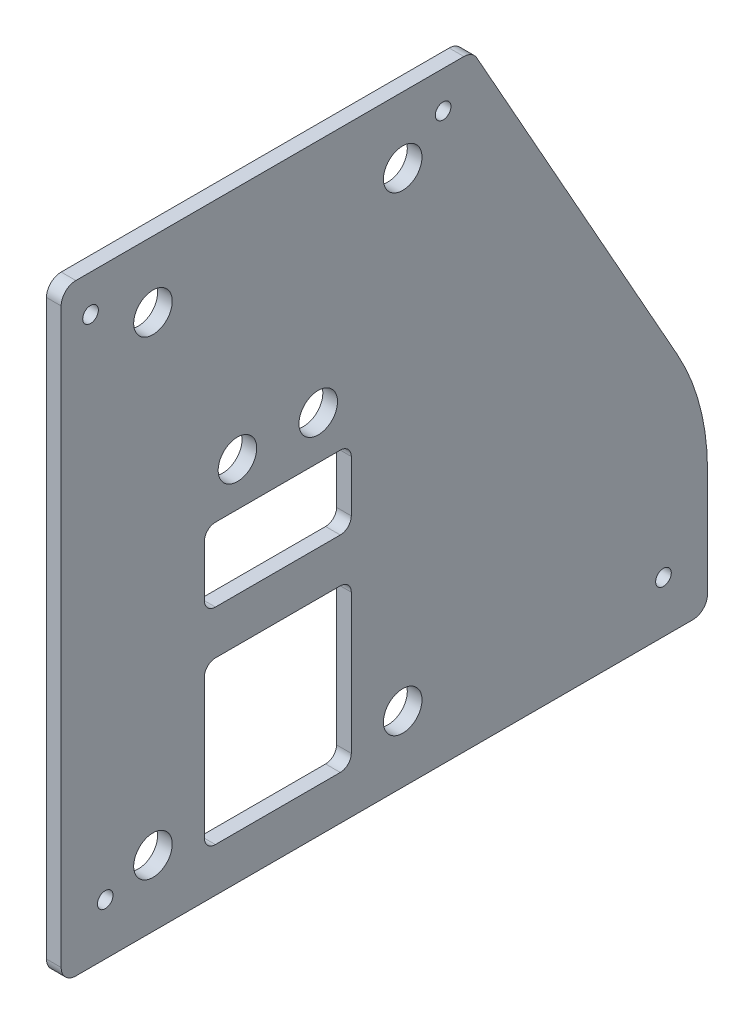
from build123d import *

# Parameters (mm, degrees)
BOSS_EXTRUDE1_DEPTH     = 6.35
F_1_4_CLEARANCE_HOLE4_D = 6.7564
F_1_4_CLEARANCE_HOLE5_D = 6.7564
FILLET4_R               = 101.6
SKETCH22_W              = 63.5
SKETCH22_H              = 69.85
SKETCH22_H_2            = 31.75
CUT_EXTRUDE1_DEPTH      = 380.794237878
F_5_8_CLEARANCE_HOLE1_D = 16.66748
FILLET5_R               = 6.35
FILLET6_R               = 4.7625


with BuildPart() as part:
    # Sketch1 → Boss-Extrude1 (new body)
    with BuildSketch(Plane(origin=(0, 0, 0), x_dir=(0, 0, -1), z_dir=(1, 0, 0))):
        Polygon((-279.4, 0), (-279.4, 257.175), (-101.6, 257.175), (0, 76.2), (0, 0), (0, -3.175), (-279.4, -3.175), align=None)
    extrude(amount=BOSS_EXTRUDE1_DEPTH)

    # 1/4 Clearance Hole4 (through all)
    with Locations(Plane(origin=(6.35, 0, 0), x_dir=(0, 0, -1), z_dir=(1, 0, 0))):
        with Locations((-266.7, 241.3), (-114.3, 241.3)):
            Hole(F_1_4_CLEARANCE_HOLE4_D / 2)

    # 1/4 Clearance Hole5 (through all)
    with Locations(Plane.ZY):
        with Locations((19.05, 19.05), (260.35, 19.05)):
            Hole(F_1_4_CLEARANCE_HOLE5_D / 2)

    # Fillet4
    fillet4_edges = [part.edges().sort_by_distance(p)[0] for p in [
        (3.175, 76.2, 0),
    ]]
    fillet(fillet4_edges, radius=FILLET4_R)

    # Sketch22 → Cut-Extrude1 (cut, through all)
    with BuildSketch(Plane(origin=(6.35, 0, 0), x_dir=(0, 0, -1), z_dir=(1, 0, 0))):
        with Locations((-185.7375, 50.8)):
            Rectangle(SKETCH22_W, SKETCH22_H)
        with Locations((-185.7375, 120.65)):
            Rectangle(SKETCH22_W, SKETCH22_H_2)
    extrude(amount=-CUT_EXTRUDE1_DEPTH, mode=Mode.SUBTRACT)

    # 5/8 Clearance Hole1 (through all)
    with Locations(Plane(origin=(6.35, 0, 0), x_dir=(0, 0, -1), z_dir=(1, 0, 0))):
        with Locations((-239.7125, 228.6), (-131.7625, 228.6), (-239.7125, 25.4), (-131.7625, 25.4), (-203.2, 155.324999992), (-168.275, 155.324999992)):
            Hole(F_5_8_CLEARANCE_HOLE1_D / 2)

    # Fillet5
    fillet5_edges = [part.edges().sort_by_distance(p)[0] for p in [
        (3.175, -3.175, 0),
        (3.175, -3.175, 279.4),
        (3.175, 257.175, 279.4),
        (3.175, 257.175, 101.6),
    ]]
    fillet(fillet5_edges, radius=FILLET5_R)

    # Fillet6
    fillet6_edges = [part.edges().sort_by_distance(p)[0] for p in [
        (3.175, 15.875, 217.4875),
        (3.175, 85.725, 217.4875),
        (3.175, 85.725, 153.9875),
        (3.175, 15.875, 153.9875),
        (3.175, 104.775, 217.4875),
        (3.175, 136.525, 217.4875),
        (3.175, 136.525, 153.9875),
        (3.175, 104.775, 153.9875),
    ]]
    fillet(fillet6_edges, radius=FILLET6_R)


solid = part.part
